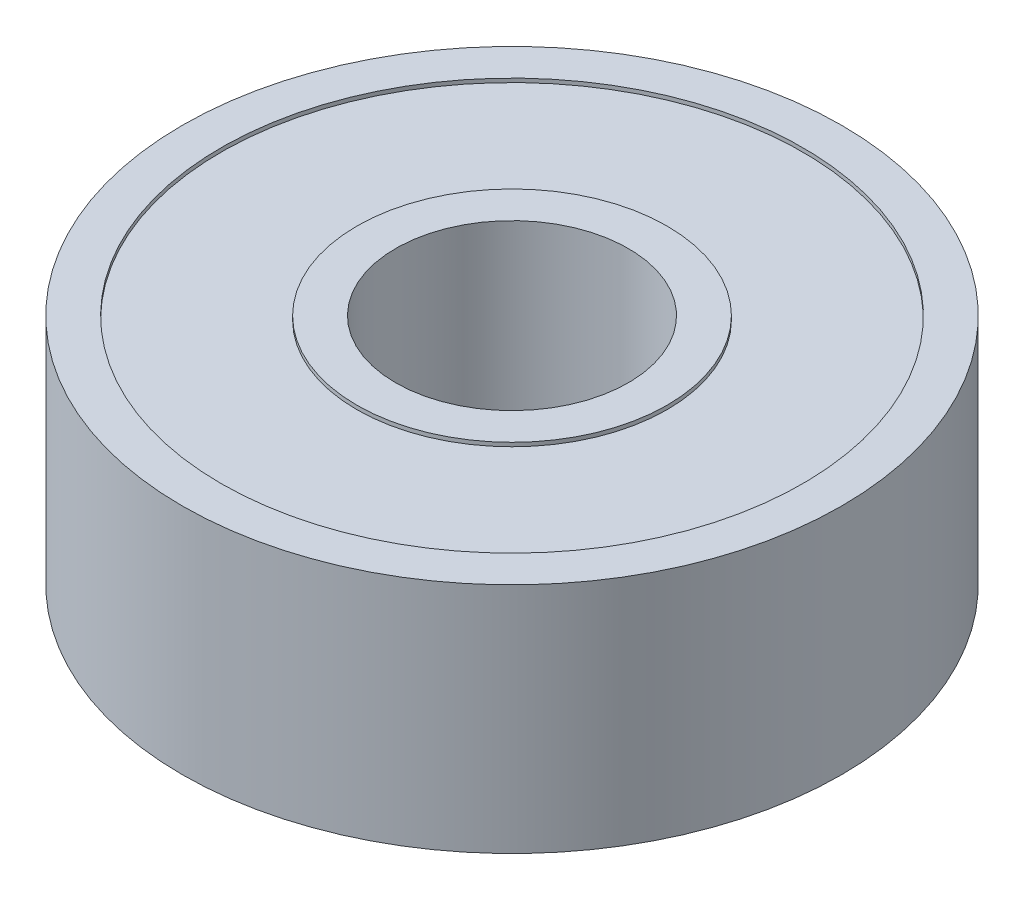
from build123d import *

# Parameters (mm, degrees)
SKETCH3_R           = 8.5
SKETCH3_R_2         = 3
BOSS_EXTRUDE2_DEPTH = 6
SKETCH4_R           = 7.5
SKETCH4_R_2         = 4
CUT_EXTRUDE2_DEPTH  = 0.1


with BuildPart() as part:
    # Sketch3 → Boss-Extrude2 (new body)
    with BuildSketch(Plane(origin=(0, 0, 0), x_dir=(1, 0, 0), z_dir=(0, 1, 0))):
        with Locations(Location((0, 0, 0), (0, 0, 270))):
            Circle(SKETCH3_R)
        with Locations(Location((0, 0, 0), (0, 0, 270))):
            Circle(SKETCH3_R_2, mode=Mode.SUBTRACT)
    extrude(amount=BOSS_EXTRUDE2_DEPTH)

    # Sketch4 → Cut-Extrude2 (cut)
    with BuildSketch(Plane(origin=(0, 6, 0), x_dir=(1, 0, 0), z_dir=(0, 1, 0))):
        with Locations(Location((0, 0, 0), (0, 0, 270))):
            Circle(SKETCH4_R)
        with Locations(Location((0, 0, 0), (0, 0, 270))):
            Circle(SKETCH4_R_2, mode=Mode.SUBTRACT)
    cut_extrude2 = extrude(amount=-CUT_EXTRUDE2_DEPTH, mode=Mode.SUBTRACT)

    # Mirror2: Cut-Extrude2 across plane
    add(cut_extrude2.mirror(Plane.ZX.offset(3)), mode=Mode.SUBTRACT)


solid = part.part
